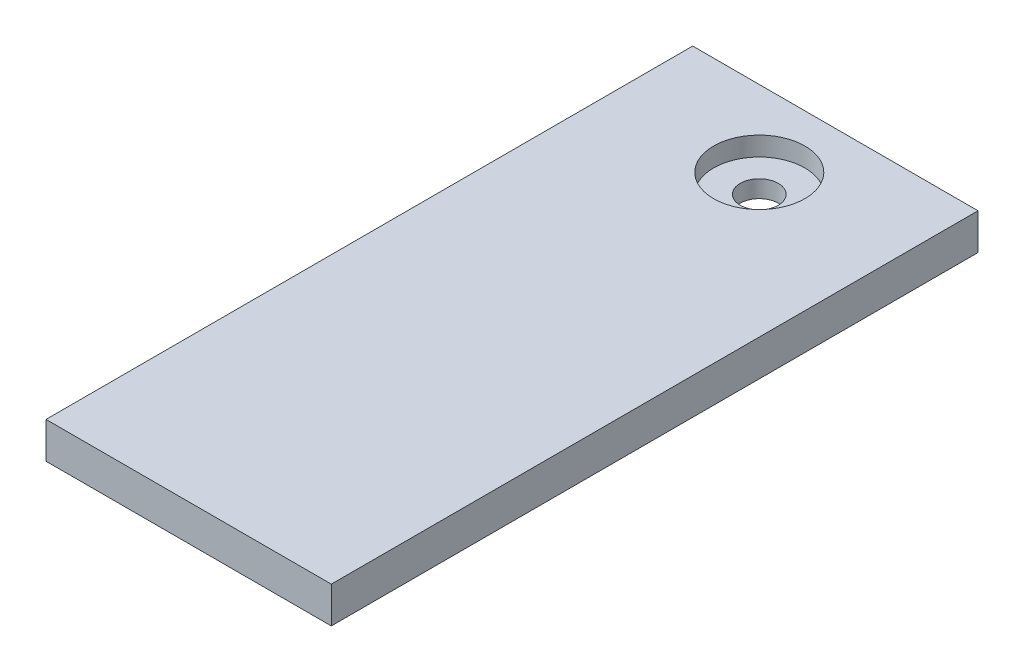
from build123d import *

# Parameters (mm, degrees)
CROQUIS1_W              = 75
CROQUIS1_H              = 170
CROQUIS1_R              = 5
SALIENTE_EXTRUIR1_DEPTH = 9.525
CROQUIS2_R              = 12
CORTAR_EXTRUIR1_DEPTH   = 5


with BuildPart() as part:
    # Croquis1 → Saliente-Extruir1 (new body)
    with BuildSketch(Plane(origin=(0, 0, 0), x_dir=(1, 0, 0), z_dir=(0, 1, 0))):
        Rectangle(CROQUIS1_W, CROQUIS1_H)
        with Locations(Location((0, 65, 0), (0, 0, 90))):
            Circle(CROQUIS1_R, mode=Mode.SUBTRACT)
    extrude(amount=SALIENTE_EXTRUIR1_DEPTH)

    # Croquis2 → Cortar-Extruir1 (cut)
    with BuildSketch(Plane(origin=(0, 9.525, 0), x_dir=(1, 0, 0), z_dir=(0, 1, 0))):
        with Locations(Location((0, 65, 0), (0, 0, 270))):
            Circle(CROQUIS2_R)
    extrude(amount=-CORTAR_EXTRUIR1_DEPTH, mode=Mode.SUBTRACT)


solid = part.part
